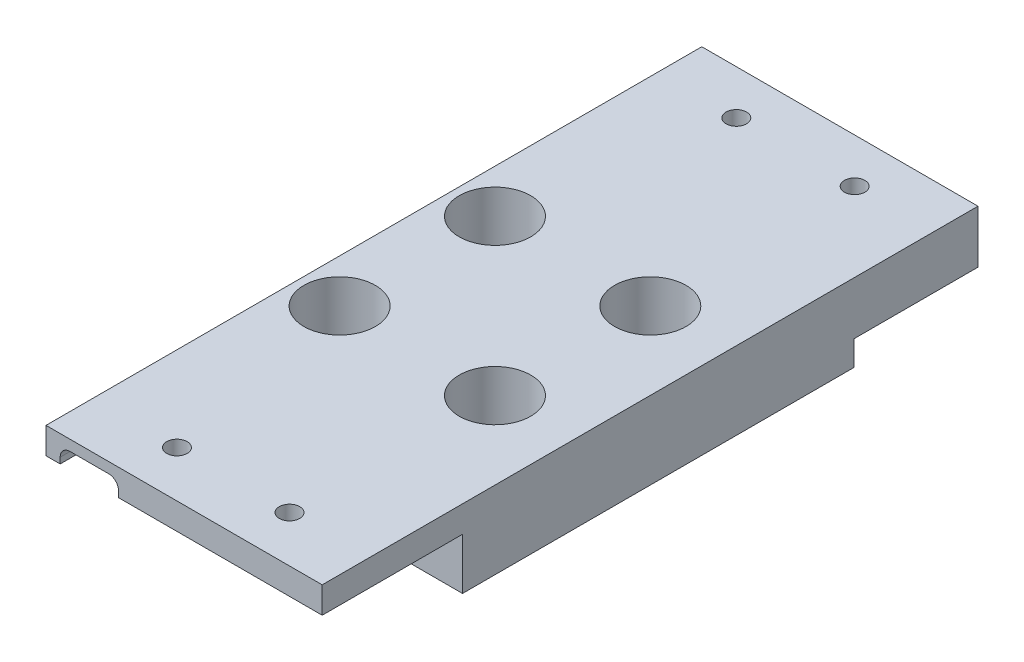
from build123d import *

# Parameters (mm, degrees)
SKETCH1_W                       = 44.45
SKETCH1_H                       = 52.7704812
EXTRUDE1_DEPTH                  = 12.5
M4X0_7_TAPPED_HOLE2_D           = 3.3
CBORE_FOR_M6_SBHCS1_D           = 6.6
CBORE_FOR_M6_SBHCS1_CBORE_D     = 11.5
CBORE_FOR_M6_SBHCS1_CBORE_DEPTH = 8.3
SKETCH6_W                       = 44.45
SKETCH6_H                       = 22.583276864
EXTRUDE2_DEPTH                  = 8.255
SKETCH7_W                       = 44.45
SKETCH7_H                       = 19.975275
EXTRUDE3_DEPTH                  = 4
SKETCH8_W                       = 9.398
SKETCH8_H                       = 22.583276864
CUT_EXTRUDE1_DEPTH              = 2.54
FILLET1_R                       = 1.5875
M4X0_7_TAPPED_HOLE3_D           = 3.3


with BuildPart() as part:
    # Sketch1 → Extrude1 (new body)
    with BuildSketch(Plane(origin=(0, 0, 0), x_dir=(1, 0, 0), z_dir=(0, 1, 0))):
        Rectangle(SKETCH1_W, SKETCH1_H)
    extrude1 = extrude(amount=EXTRUDE1_DEPTH)

    # M4x0.7 Tapped Hole2 (through all)
    with Locations(Plane(origin=(0, 12.5, 0), x_dir=(-1, 0, 0), z_dir=(0, 1, 0))):
        with Locations((9.525000018, -19.236265325), (-9.525000018, -19.236265325)):
            Hole(M4X0_7_TAPPED_HOLE2_D / 2)

    # CBORE for M6 SBHCS1 (through all)
    with Locations(Plane(origin=(0, 12.5, 0), x_dir=(-1, 0, 0), z_dir=(0, 1, 0))):
        with Locations((15.24, 13.8852406), (-9.76, 13.8852406)):
            cbore_for_m6_sbhcs1 = CounterBoreHole(CBORE_FOR_M6_SBHCS1_D / 2, CBORE_FOR_M6_SBHCS1_CBORE_D / 2, CBORE_FOR_M6_SBHCS1_CBORE_DEPTH)

    # Mirror1: Extrude1, CBORE for M6 SBHCS1 across plane
    add(extrude1.mirror(Plane(origin=(-22.225, 12.5, 26.3852406), x_dir=(1, 0, 0), z_dir=(0, 0, -1))))
    add(cbore_for_m6_sbhcs1.mirror(Plane(origin=(-22.225, 12.5, 26.3852406), x_dir=(1, 0, 0), z_dir=(0, 0, -1))), mode=Mode.SUBTRACT)

    # Sketch6 → Extrude2 (cut)
    with BuildSketch(Plane.XZ):
        with Locations((0, 67.864083368)):
            Rectangle(SKETCH6_W, SKETCH6_H)
    extrude(amount=-EXTRUDE2_DEPTH, mode=Mode.SUBTRACT)

    # Sketch7 → Extrude3 (cut)
    with BuildSketch(Plane.XZ):
        with Locations((0, -16.3976031)):
            Rectangle(SKETCH7_W, SKETCH7_H)
    extrude(amount=-EXTRUDE3_DEPTH, mode=Mode.SUBTRACT)

    # Sketch8 → Cut-Extrude1 (cut)
    with BuildSketch(Plane.XZ.offset(-8.255)):
        with Locations((-15.2432004, 67.864083368)):
            Rectangle(SKETCH8_W, SKETCH8_H)
    extrude(amount=-CUT_EXTRUDE1_DEPTH, mode=Mode.SUBTRACT)

    # Fillet1
    fillet1_edges = [part.edges().sort_by_distance(p)[0] for p in [
        (-10.5442004, 9.525, 56.572444936),
        (-19.9422004, 10.795, 67.864083368),
        (-19.9422004, 9.525, 56.572444936),
        (-10.5442004, 10.795, 67.864083368),
        (-15.2432004, 10.795, 56.572444936),
    ]]
    fillet(fillet1_edges, radius=FILLET1_R)

    # M4x0.7 Tapped Hole3 (through all)
    with Locations(Plane(origin=(0, 12.5, 0), x_dir=(-1, 0, 0), z_dir=(0, 1, 0))):
        with Locations((-9.524999982, 71.7115406), (8.596896608, 71.7115406)):
            Hole(M4X0_7_TAPPED_HOLE3_D / 2)


solid = part.part
